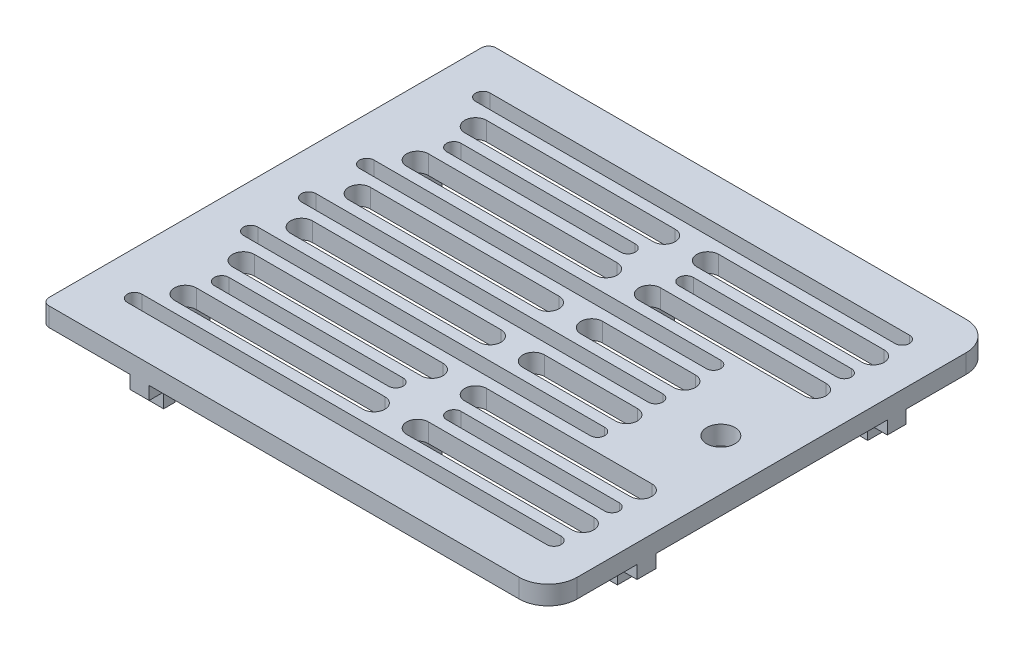
from build123d import *

# Parameters (mm, degrees)
BOSS_EXTRUDE1_DEPTH = 2.6
SKETCH3_R           = 1.7
SKETCH3_R_2         = 0.75
BOSS_EXTRUDE2_DEPTH = 4.4
CUT_EXTRUDE1_DEPTH  = 48.070691518
LPATTERN1_COUNT     = 6
LPATTERN1_PITCH     = 8
SKETCH4_R           = 1.95
CUT_EXTRUDE2_DEPTH  = 47.754785851
SKETCH6_W           = 2.6
SKETCH6_H           = 3.6
SKETCH6_W_2         = 4.3
SKETCH6_H_2         = 2.6
BOSS_EXTRUDE4_DEPTH = 1.8
SKETCH7_W           = 2.6
SKETCH7_H           = 1.6
SKETCH7_W_2         = 1.6
SKETCH7_H_2         = 2.6
BOSS_EXTRUDE5_DEPTH = 2
BOSS_EXTRUDE6_START = -2.6
BOSS_EXTRUDE6_DEPTH = 2.6
SKETCH9_R           = 8.5
SKETCH9_R_2         = 4.3
BOSS_EXTRUDE7_DEPTH = 4
SKETCH12_R          = 0.95
CUT_EXTRUDE3_DEPTH  = 4
SKETCH13_W          = 11.452487144
SKETCH13_H          = 18.554951014
SKETCH13_W_2        = 15.080629567
SKETCH13_H_2        = 21.043729538
CUT_EXTRUDE4_DEPTH  = 4
FILLET1_R           = 1
FILLET2_R           = 1


with BuildPart() as part:
    # Sketch1 → Boss-Extrude1 (new body)
    with BuildSketch(Plane(origin=(0, 0, 0), x_dir=(1, 0, 0), z_dir=(0, 1, 0))):
        with BuildLine():
            Line((-33.9, -30.8), (30.9, -30.8))
            ThreePointArc((30.9, -30.8), (33.728427125, -29.628427125), (34.9, -26.8))
            Line((34.9, -26.8), (34.9, 26.8))
            ThreePointArc((34.9, 26.8), (33.728427125, 29.628427125), (30.9, 30.8))
            Line((30.9, 30.8), (-33.9, 30.8))
            ThreePointArc((-33.9, 30.8), (-34.607106781, 30.507106781), (-34.9, 29.8))
            Line((-34.9, 29.8), (-34.9, -29.8))
            ThreePointArc((-34.9, -29.8), (-34.607106781, -30.507106781), (-33.9, -30.8))
        make_face()
    extrude(amount=BOSS_EXTRUDE1_DEPTH)

    # Sketch3 → Boss-Extrude2 (add)
    # profile 1 of 4: a face of its own
    with BuildSketch(Plane.XZ):
        with Locations(Location((-28.9, 16, 0), (0, 0, 270))):
            Circle(SKETCH3_R)
        with Locations(Location((-28.9, 16, 0), (0, 0, 270))):
            Circle(SKETCH3_R_2, mode=Mode.SUBTRACT)
    # profile 2 of 4: a face of its own
    with BuildSketch(Plane.XZ):
        with Locations(Location((3.1, 16, 0), (0, 0, 270))):
            Circle(SKETCH3_R)
        with Locations(Location((3.1, 16, 0), (0, 0, 270))):
            Circle(SKETCH3_R_2, mode=Mode.SUBTRACT)
    # profile 3 of 4: a face of its own
    with BuildSketch(Plane.XZ):
        with Locations(Location((-28.9, -16, 0), (0, 0, 270))):
            Circle(SKETCH3_R)
        with Locations(Location((-28.9, -16, 0), (0, 0, 270))):
            Circle(SKETCH3_R_2, mode=Mode.SUBTRACT)
    # profile 4 of 4: a face of its own
    with BuildSketch(Plane.XZ):
        with Locations(Location((3.1, -16, 0), (0, 0, 270))):
            Circle(SKETCH3_R)
        with Locations(Location((3.1, -16, 0), (0, 0, 270))):
            Circle(SKETCH3_R_2, mode=Mode.SUBTRACT)
    extrude(amount=BOSS_EXTRUDE2_DEPTH)

    # Sketch2 → Cut-Extrude1 (cut, through all)
    with BuildSketch(Plane(origin=(0, 2.6, 0), x_dir=(1, 0, 0), z_dir=(0, 1, 0))):
        with BuildLine():
            Line((28.9, -21.5), (6.1, -21.5))
            ThreePointArc((6.1, -21.5), (4.6, -20), (6.1, -18.5))
            Line((6.1, -18.5), (28.9, -18.5))
            ThreePointArc((28.9, -18.5), (30.4, -20), (28.9, -21.5))
        make_face()
        with BuildLine():
            Line((0.1, -21.5), (-25.9, -21.5))
            ThreePointArc((-25.9, -21.5), (-27.4, -20), (-25.9, -18.5))
            Line((-25.9, -18.5), (0.1, -18.5))
            ThreePointArc((0.1, -18.5), (1.6, -20), (0.1, -21.5))
        make_face()
    cut_extrude1 = extrude(amount=-CUT_EXTRUDE1_DEPTH, mode=Mode.SUBTRACT)

    # LPattern1: Cut-Extrude1 ×6
    with Locations(*[(0, 0, -i * LPATTERN1_PITCH) for i in range(1, LPATTERN1_COUNT)]):
        add(cut_extrude1, mode=Mode.SUBTRACT)

    # Sketch4 → Cut-Extrude2 (cut, through all)
    with BuildSketch(Plane.XZ):
        with Locations(Location((27.9, 0, 0), (0, 0, 270))):
            Circle(SKETCH4_R)
        with BuildLine():
            Line((-28.9, 25), (28.9, 25))
            ThreePointArc((28.9, 25), (29.9, 24), (28.9, 23))
            Line((28.9, 23), (-28.9, 23))
            ThreePointArc((-28.9, 23), (-29.9, 24), (-28.9, 25))
        make_face()
        with BuildLine():
            Line((-24.9, 17), (-0.9, 17))
            ThreePointArc((-0.9, 17), (0.1, 16), (-0.9, 15))
            Line((-0.9, 15), (-24.9, 15))
            ThreePointArc((-24.9, 15), (-25.9, 16), (-24.9, 17))
        make_face()
        with BuildLine():
            Line((7.1, 17), (28.9, 17))
            ThreePointArc((28.9, 17), (29.9, 16), (28.9, 15))
            Line((28.9, 15), (7.1, 15))
            ThreePointArc((7.1, 15), (6.1, 16), (7.1, 17))
        make_face()
        with BuildLine():
            Line((-24.9, -15), (-0.9, -15))
            ThreePointArc((-0.9, -15), (0.1, -16), (-0.9, -17))
            Line((-0.9, -17), (-24.9, -17))
            ThreePointArc((-24.9, -17), (-25.9, -16), (-24.9, -15))
        make_face()
        with BuildLine():
            Line((7.1, -15), (28.9, -15))
            ThreePointArc((28.9, -15), (29.9, -16), (28.9, -17))
            Line((28.9, -17), (7.1, -17))
            ThreePointArc((7.1, -17), (6.1, -16), (7.1, -15))
        make_face()
        with BuildLine():
            Line((-28.9, -23), (28.9, -23))
            ThreePointArc((28.9, -23), (29.9, -24), (28.9, -25))
            Line((28.9, -25), (-28.9, -25))
            ThreePointArc((-28.9, -25), (-29.9, -24), (-28.9, -23))
        make_face()
        with BuildLine():
            Line((-28.9, 9), (18.9, 9))
            ThreePointArc((18.9, 9), (19.9, 8), (18.9, 7))
            Line((18.9, 7), (-28.9, 7))
            ThreePointArc((-28.9, 7), (-29.9, 8), (-28.9, 9))
        make_face()
        with BuildLine():
            Line((18.9, -1), (-28.9, -1))
            ThreePointArc((-28.9, -1), (-29.9, 0), (-28.9, 1))
            Line((-28.9, 1), (18.9, 1))
            ThreePointArc((18.9, 1), (19.9, 0), (18.9, -1))
        make_face()
        with BuildLine():
            Line((-28.9, -7), (18.9, -7))
            ThreePointArc((18.9, -7), (19.9, -8), (18.9, -9))
            Line((18.9, -9), (-28.9, -9))
            ThreePointArc((-28.9, -9), (-29.9, -8), (-28.9, -7))
        make_face()
    extrude(amount=-CUT_EXTRUDE2_DEPTH, mode=Mode.SUBTRACT)

    # Sketch6 → Boss-Extrude4 (add)
    with BuildSketch(Plane.XZ):
        with Locations((-21.4, 29)):
            Rectangle(SKETCH6_W, SKETCH6_H)
        with Locations((-21.4, -29)):
            Rectangle(SKETCH6_W, SKETCH6_H)
        with Locations((32.75, 17.25)):
            Rectangle(SKETCH6_W_2, SKETCH6_H_2)
        with Locations((32.75, -17.25)):
            Rectangle(SKETCH6_W_2, SKETCH6_H_2)
    extrude(amount=BOSS_EXTRUDE4_DEPTH)

    # Sketch7 → Boss-Extrude5 (add)
    with BuildSketch(Plane.XZ.offset(1.8)):
        with Locations((-21.4, 28)):
            Rectangle(SKETCH7_W, SKETCH7_H)
        with Locations((31.4, 17.25)):
            Rectangle(SKETCH7_W_2, SKETCH7_H_2)
        with Locations((31.4, -17.25)):
            Rectangle(SKETCH7_W_2, SKETCH7_H_2)
        with Locations((-21.4, -28)):
            Rectangle(SKETCH7_W, SKETCH7_H)
    extrude(amount=BOSS_EXTRUDE5_DEPTH)

    # Sketch8 → Boss-Extrude6 (add)
    with BuildSketch(Plane.XZ.offset(BOSS_EXTRUDE6_START)):
        with BuildLine():
            Line((28.9, -5.5), (18.9, -5.5))
            ThreePointArc((18.9, -5.5), (20.4, -4), (18.9, -2.5))
            Line((18.9, -2.5), (28.9, -2.5))
            ThreePointArc((28.9, -2.5), (30.4, -4), (28.9, -5.5))
        make_face()
        with BuildLine():
            Line((28.9, 2.5), (18.9, 2.5))
            ThreePointArc((18.9, 2.5), (20.4, 4), (18.9, 5.5))
            Line((18.9, 5.5), (28.9, 5.5))
            ThreePointArc((28.9, 5.5), (30.4, 4), (28.9, 2.5))
        make_face()
    extrude(amount=BOSS_EXTRUDE6_DEPTH)

    # Sketch9 → Boss-Extrude7 (add)
    with BuildSketch(Plane.XZ):
        with Locations(Location((27.9, 0, 0), (0, 0, 34.56032178))):
            Circle(SKETCH9_R)
        with Locations(Location((27.9, 0, 0), (0, 0, 270))):
            Circle(SKETCH9_R_2, mode=Mode.SUBTRACT)
    extrude(amount=BOSS_EXTRUDE7_DEPTH)

    # Sketch12 → Cut-Extrude3 (cut)
    with BuildSketch(Plane.XZ.offset(4)):
        with Locations(Location((27.9, 6.15, 0), (0, 0, 270))):
            Circle(SKETCH12_R)
        with Locations(Location((27.9, -6.15, 0), (0, 0, 270))):
            Circle(SKETCH12_R)
    extrude(amount=-CUT_EXTRUDE3_DEPTH, mode=Mode.SUBTRACT)

    # Sketch13 → Cut-Extrude4 (cut)
    with BuildSketch(Plane.XZ.offset(4)):
        with Locations((36.626243572, 0.035430506)):
            Rectangle(SKETCH13_W, SKETCH13_H)
        with Locations((17.359685217, 0.379129228)):
            Rectangle(SKETCH13_W_2, SKETCH13_H_2)
    extrude(amount=-CUT_EXTRUDE4_DEPTH, mode=Mode.SUBTRACT)

    # Fillet1
    fillet1_edges = [part.edges().sort_by_distance(p)[0] for p in [
        (24.9, -2, 3.08058436),
        (24.9, -2, -3.08058436),
        (30.9, -2, -3.08058436),
        (30.9, -2, 3.08058436),
    ]]
    fillet(fillet1_edges, radius=FILLET1_R)

    # Fillet2
    fillet2_edges = [part.edges().sort_by_distance(p)[0] for p in [
        (30.9, -2, 7.95298686),
        (30.9, -2, -7.95298686),
        (24.9, -2, -7.95298686),
        (24.9, -2, 7.95298686),
    ]]
    fillet(fillet2_edges, radius=FILLET2_R)


solid = part.part
